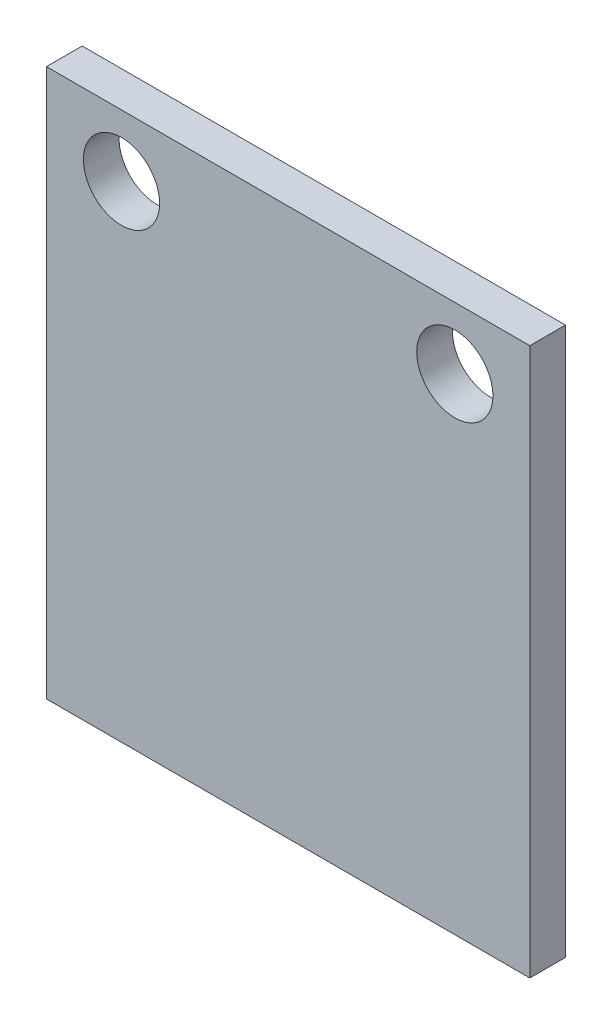
from build123d import *

# Parameters (mm, degrees)
SKETCH_1_W      = 20.3
SKETCH_1_H      = 23
SKETCH_1_R      = 1.6
EXTRUDE_1_DEPTH = 1.5


with BuildPart() as part:
    # Эскиз1 → Бобышка-Вытянуть1 (new body)
    with BuildSketch(Plane.XY):
        Rectangle(SKETCH_1_W, SKETCH_1_H)
        with Locations((-7, 8.9)):
            Circle(SKETCH_1_R, mode=Mode.SUBTRACT)
        with Locations(Location((7, 8.9, 0), (0, 0, 180))):
            Circle(SKETCH_1_R, mode=Mode.SUBTRACT)
    extrude(amount=EXTRUDE_1_DEPTH)


solid = part.part
